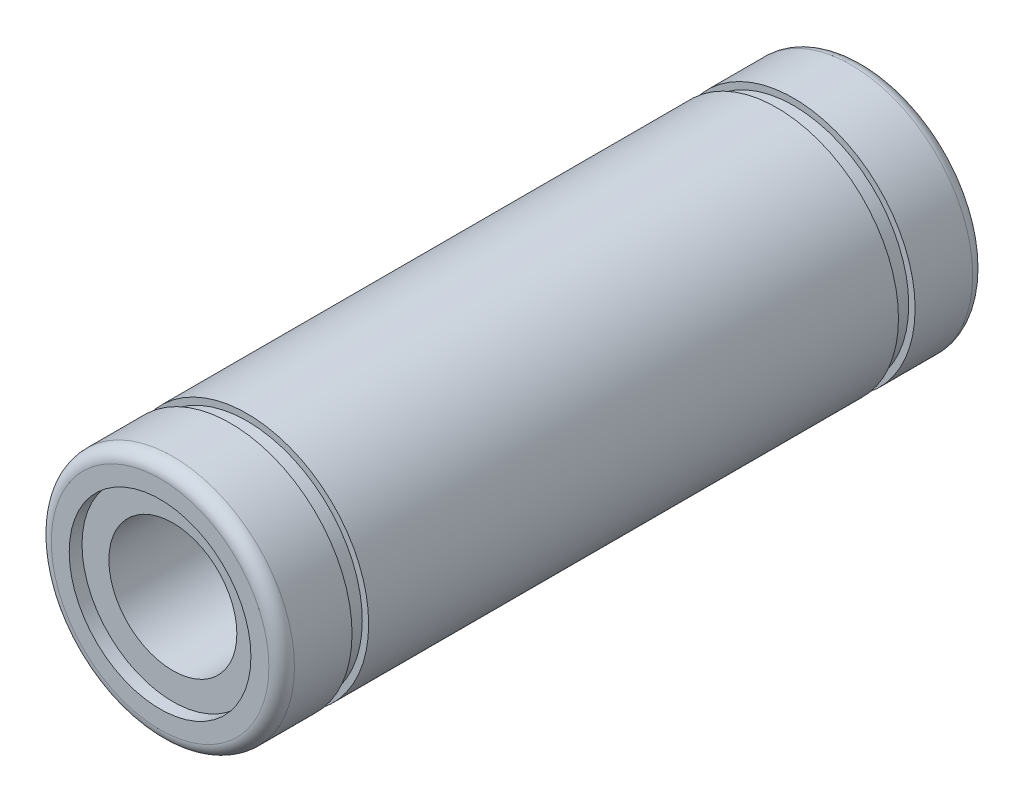
from build123d import *

# Parameters (mm, degrees)
SKETCH1_R           = 9.5
SKETCH1_R_2         = 5
BOSS_EXTRUDE1_DEPTH = 55
SKETCH2_R           = 7.1
CUT_EXTRUDE1_DEPTH  = 1
CUT_EXTRUDE2_START  = -1
SKETCH3_R           = 7.1
CUT_EXTRUDE2_DEPTH  = 1
SKETCH4_W           = 0.5
SKETCH4_H           = 1.3
FILLET1_R           = 1


with BuildPart() as part:
    # Sketch1 → Boss-Extrude1 (new body)
    with BuildSketch(Plane.XY):
        Circle(SKETCH1_R)
        Circle(SKETCH1_R_2, mode=Mode.SUBTRACT)
    extrude(amount=BOSS_EXTRUDE1_DEPTH)

    # Sketch2 → Cut-Extrude1 (cut)
    with BuildSketch(Plane.XY.offset(55)):
        Circle(SKETCH2_R)
    extrude(amount=-CUT_EXTRUDE1_DEPTH, mode=Mode.SUBTRACT)

    # Sketch3 → Cut-Extrude2 (cut)
    with BuildSketch(Plane(origin=(0, 0, 0), x_dir=(-1, 0, 0), z_dir=(0, 0, -1)).offset(CUT_EXTRUDE2_START)):
        Circle(SKETCH3_R)
    extrude(amount=CUT_EXTRUDE2_DEPTH, mode=Mode.SUBTRACT)

    # Sketch4 → Cut-Revolve1 (revolve, cut)
    with BuildSketch(Plane(origin=(0, 0, 0), x_dir=(1, 0, 0), z_dir=(0, 1, 0))):
        with Locations((-9.25, -48.85)):
            Rectangle(SKETCH4_W, SKETCH4_H)
        with Locations((-9.25, -6.15)):
            Rectangle(SKETCH4_W, SKETCH4_H)
    revolve(axis=Axis((0, 0, 0), (0, 0, 1)), mode=Mode.SUBTRACT)

    # Fillet1
    fillet1_edges = [part.edges().sort_by_distance(p)[0] for p in [
        (-9.5, 0, 55),
        (-9.5, 0, 0),
    ]]
    fillet(fillet1_edges, radius=FILLET1_R)


solid = part.part
